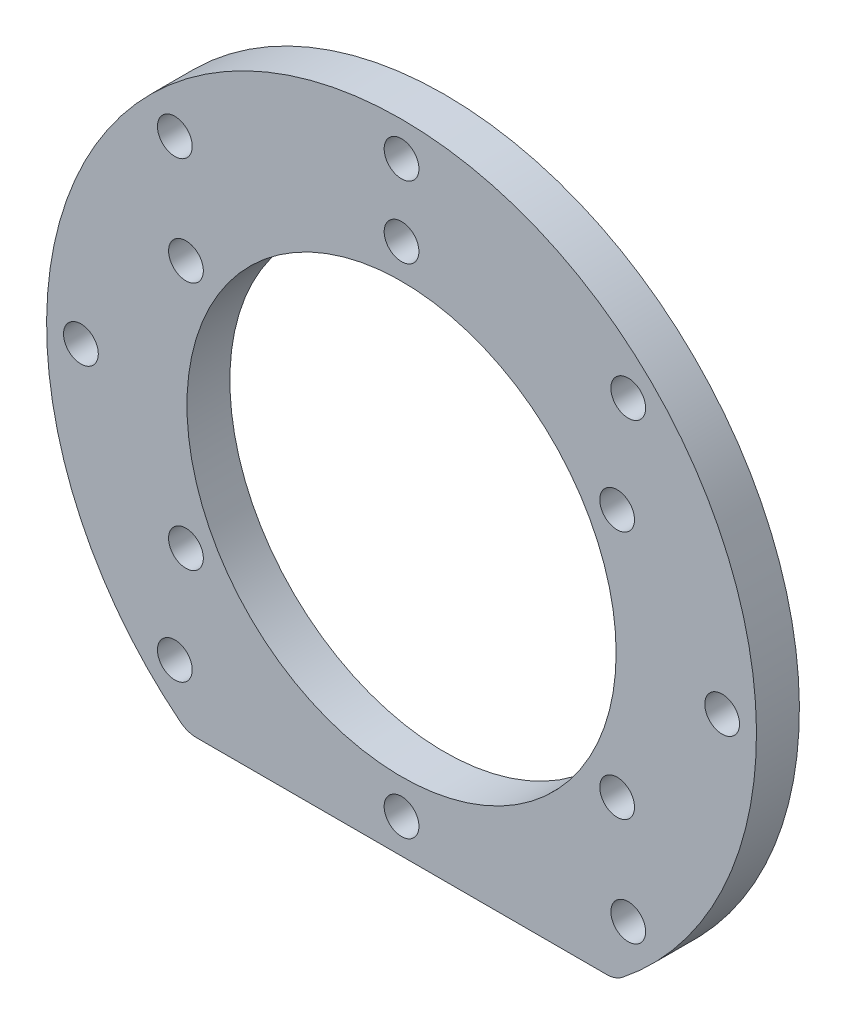
from build123d import *

# Parameters (mm, degrees)
SKETCH_1_R          = 41.35
SKETCH_1_R_2        = 2.025
SKETCH_1_R_3        = 25
EXTRUDE_1_DEPTH     = 5
SKETCH_2_R          = 2.025
CUT_EXTRUDE_1_DEPTH = 5
CUT_EXTRUDE_START   = -5
CUT_EXTRUDE_2_DEPTH = 5
FILLET_1_R          = 3


with BuildPart() as part:
    # 草图1 → 凸台-拉伸1 (new body)
    with BuildSketch(Plane.XY):
        Circle(SKETCH_1_R)
        with Locations((0, 29)):
            Circle(SKETCH_1_R_2, mode=Mode.SUBTRACT)
        with Locations((25.11473671, 14.5)):
            Circle(SKETCH_1_R_2, mode=Mode.SUBTRACT)
        with Locations((25.11473671, -14.5)):
            Circle(SKETCH_1_R_2, mode=Mode.SUBTRACT)
        with Locations((0, -29)):
            Circle(SKETCH_1_R_2, mode=Mode.SUBTRACT)
        with Locations((-25.11473671, -14.5)):
            Circle(SKETCH_1_R_2, mode=Mode.SUBTRACT)
        with Locations((-25.11473671, 14.5)):
            Circle(SKETCH_1_R_2, mode=Mode.SUBTRACT)
        Circle(SKETCH_1_R_3, mode=Mode.SUBTRACT)
    extrude(amount=EXTRUDE_1_DEPTH)

    # 草图2 → 切除-拉伸1 (cut)
    with BuildSketch(Plane.XY.offset(5)):
        with Locations((0, 37.35)):
            Circle(SKETCH_2_R)
        with Locations((26.410438277, 26.410438277)):
            Circle(SKETCH_2_R)
        with Locations((37.35, 0)):
            Circle(SKETCH_2_R)
        with Locations((26.410438277, -26.410438277)):
            Circle(SKETCH_2_R)
        with Locations((0, -37.35)):
            Circle(SKETCH_2_R)
        with Locations((-26.410438277, -26.410438277)):
            Circle(SKETCH_2_R)
        with Locations((-37.35, 0)):
            Circle(SKETCH_2_R)
        with Locations((-26.410438277, 26.410438277)):
            Circle(SKETCH_2_R)
    extrude(amount=-CUT_EXTRUDE_1_DEPTH, mode=Mode.SUBTRACT)

    # 草图3 → 切除-拉伸2 (cut)
    with BuildSketch(Plane.XY.offset(5).offset(CUT_EXTRUDE_START)):
        with BuildLine():
            Line((-24.916309919, -33), (24.916309919, -33))
            ThreePointArc((24.916309919, -33), (0, -41.35), (-24.916309919, -33))
        make_face()
    extrude(amount=CUT_EXTRUDE_2_DEPTH, mode=Mode.SUBTRACT)

    # 圆角1
    fillet_1_edges = [part.edges().sort_by_distance(p)[0] for p in [
        (24.916309919, -33, 2.5),
        (-24.916309919, -33, 2.5),
    ]]
    fillet(fillet_1_edges, radius=FILLET_1_R)


solid = part.part
